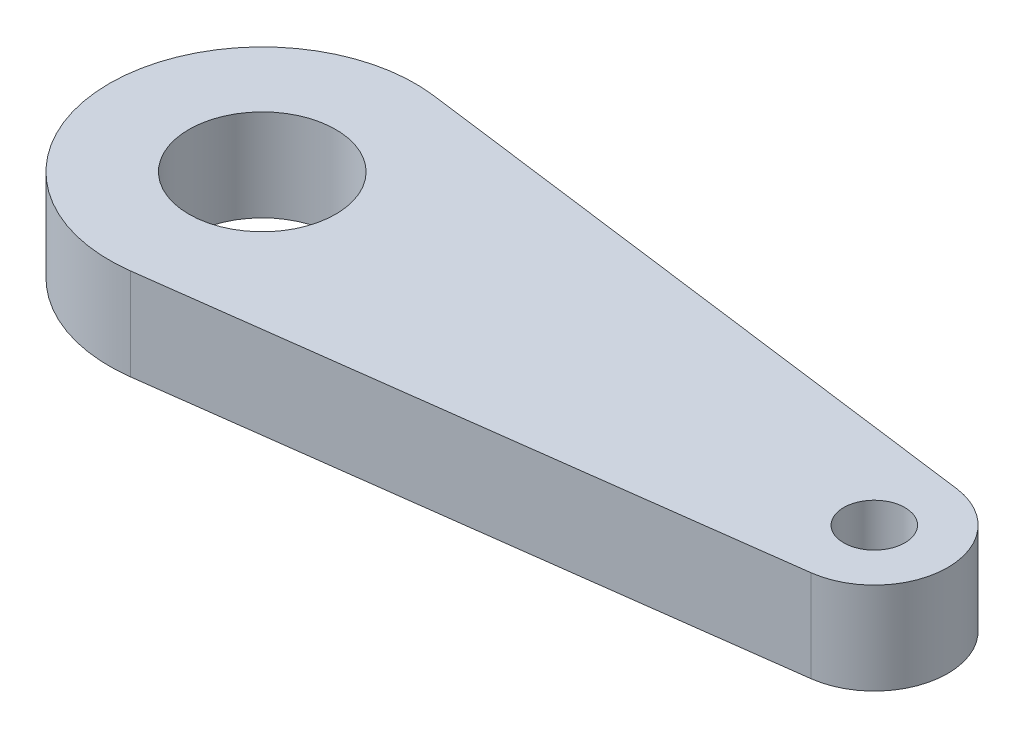
from build123d import *

# Parameters (mm, degrees)
SKETCH1_R           = 6
SKETCH1_R_2         = 2.5
BOSS_EXTRUDE1_DEPTH = 7.5


with BuildPart() as part:
    # Sketch1 → Boss-Extrude1 (new body)
    with BuildSketch(Plane(origin=(0, 0, 0), x_dir=(1, 0, 0), z_dir=(0, 1, 0))):
        with BuildLine():
            Line((-23.375, -12.393924923), (25.78, -5.949083963))
            ThreePointArc((25.78, -5.949083963), (31, 0), (25.78, 5.949083963))
            Line((25.78, 5.949083963), (-23.375, 12.393924923))
            ThreePointArc((-23.375, 12.393924923), (-37.5, 0), (-23.375, -12.393924923))
        make_face()
        with Locations(Location((-25, 0, 0), (0, 0, 270))):
            Circle(SKETCH1_R, mode=Mode.SUBTRACT)
        with Locations(Location((25, 0, 0), (0, 0, 270))):
            Circle(SKETCH1_R_2, mode=Mode.SUBTRACT)
    extrude(amount=BOSS_EXTRUDE1_DEPTH)


solid = part.part
